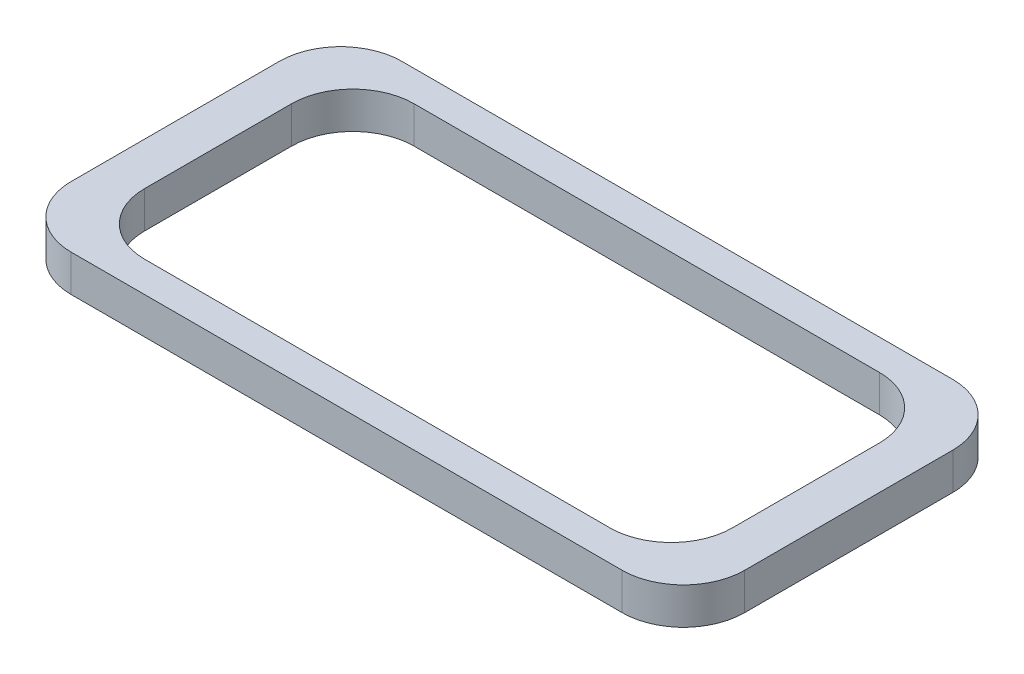
from build123d import *

# Parameters (mm, degrees)
BOSS_EXTRUDE1_DEPTH = 3


with BuildPart() as part:
    # Sketch1 → Boss-Extrude1 (new body)
    with BuildSketch(Plane(origin=(0, 0, 0), x_dir=(1, 0, 0), z_dir=(0, 1, 0))):
        with BuildLine():
            Line((-22.5, 13.5), (22.5, 13.5))
            ThreePointArc((22.5, 13.5), (26.035533906, 12.035533906), (27.5, 8.5))
            Line((27.5, 8.5), (27.5, -8.5))
            ThreePointArc((27.5, -8.5), (26.035533906, -12.035533906), (22.5, -13.5))
            Line((22.5, -13.5), (-22.5, -13.5))
            ThreePointArc((-22.5, -13.5), (-26.035533906, -12.035533906), (-27.5, -8.5))
            Line((-27.5, -8.5), (-27.5, 8.5))
            ThreePointArc((-27.5, 8.5), (-26.035533906, 12.035533906), (-22.5, 13.5))
        make_face()
        with BuildLine():
            Line((-19, -11), (19, -11))
            ThreePointArc((19, -11), (22.535533906, -9.535533906), (24, -6))
            Line((24, -6), (24, 6))
            ThreePointArc((24, 6), (22.535533906, 9.535533906), (19, 11))
            Line((19, 11), (-19, 11))
            ThreePointArc((-19, 11), (-22.535533906, 9.535533906), (-24, 6))
            Line((-24, 6), (-24, -6))
            ThreePointArc((-24, -6), (-22.535533906, -9.535533906), (-19, -11))
        make_face(mode=Mode.SUBTRACT)
    extrude(amount=BOSS_EXTRUDE1_DEPTH)


solid = part.part
